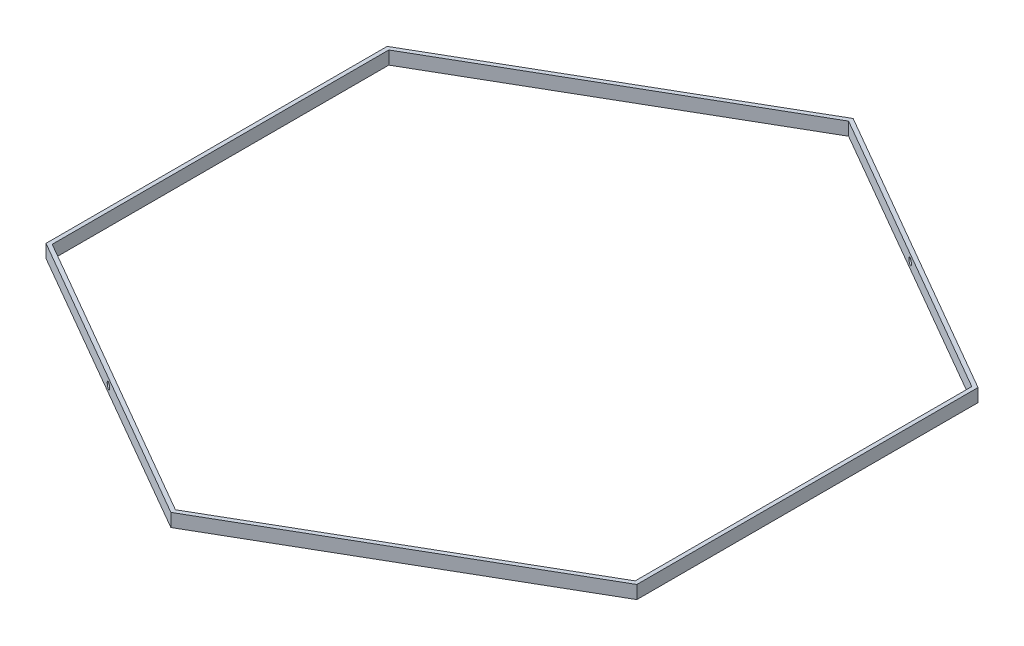
from build123d import *

# Parameters (mm, degrees)
RESSALTO_EXTRUS_O1_DEPTH = 4
ESBO_O2_R                = 1
CORTE_EXTRUS_O1_DEPTH    = 227.530351167


with BuildPart() as part:
    # Esboço1 → Ressalto-extrusão1 (new body)
    with BuildSketch(Plane(origin=(0, 0, 0), x_dir=(1, 0, 0), z_dir=(0, 1, 0))):
        Polygon((90, -51.961524227), (90, 51.961524227), (0, 103.923048454), (-90, 51.961524227), (-90, -51.961524227), (0, -103.923048454), align=None)
        Polygon((88.8, 51.268703904), (0, 102.537407808), (-88.8, 51.268703904), (-88.8, -51.268703904), (0, -102.537407808), (88.8, -51.268703904), align=None, mode=Mode.SUBTRACT)
    extrude(amount=RESSALTO_EXTRUS_O1_DEPTH)

    # Esboço2 → Corte-extrusão1 (cut, through all)
    with BuildSketch(Plane(origin=(-45, 0, 77.942286341), x_dir=(0.8660254037844387, 0, 0.49999999999999994), z_dir=(-0.4999999999999999, 0, 0.8660254037844386))):
        with Locations((0, 2)):
            Circle(ESBO_O2_R)
    extrude(amount=-CORTE_EXTRUS_O1_DEPTH, mode=Mode.SUBTRACT)


solid = part.part
